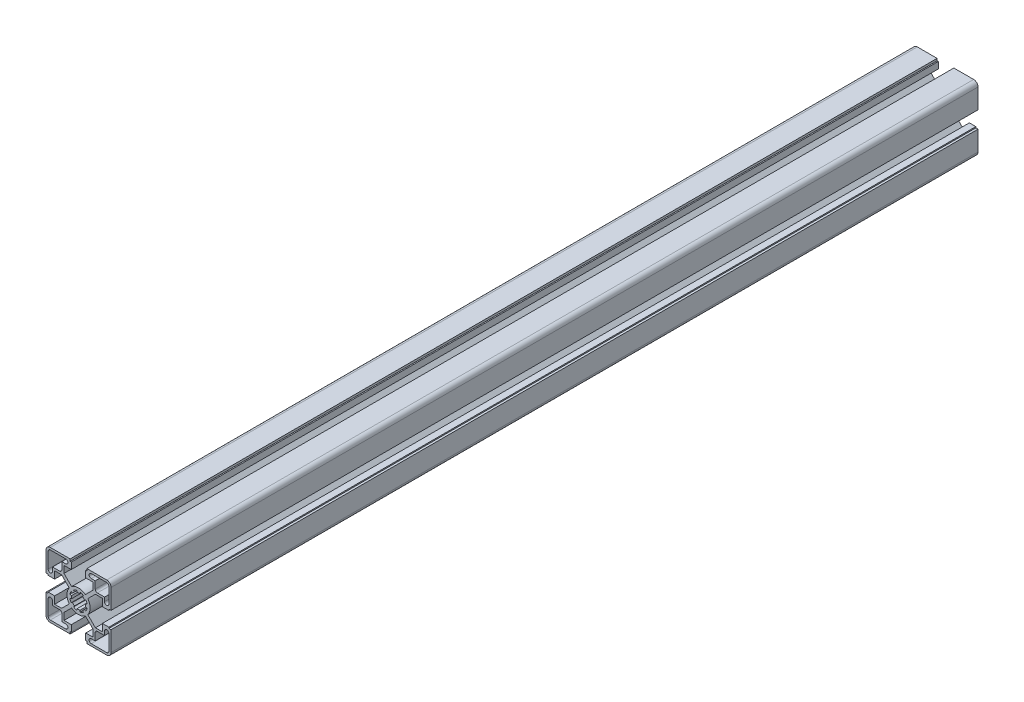
from build123d import *

# Parameters (mm, degrees)
BOSS_EXTRUDE1_DEPTH = 300


with BuildPart() as part:
    # Sketch1 → Boss-Extrude1 (new, symmetric)
    with BuildSketch(Plane.XY):
        with BuildLine():
            Line((-19.5072, 22.5044), (-5.7912, 22.5044))
            Line((-5.7912, 22.5044), (-5.7912, 21.0058))
            Line((-5.7912, 21.0058), (-5.0038, 21.0058))
            Line((-5.0038, 21.0058), (-5.0038, 16.51))
            Line((-5.0038, 16.51), (-10.0457, 16.51))
            Line((-10.0457, 16.51), (-10.0457, 11.680106614))
            Line((-10.0457, 11.680106614), (-4.781026704, 6.415433318))
            ThreePointArc((-4.781026704, 6.415433318), (0, 8.001), (4.781026704, 6.415433318))
            Line((4.781026704, 6.415433318), (10.0457, 11.680106614))
            Line((10.0457, 11.680106614), (10.0457, 16.51))
            Line((10.0457, 16.51), (5.0038, 16.51))
            Line((5.0038, 16.51), (5.0038, 21.0058))
            Line((5.0038, 21.0058), (5.7912, 21.0058))
            Line((5.7912, 21.0058), (5.7912, 22.5044))
            Line((5.7912, 22.5044), (19.5072, 22.5044))
            ThreePointArc((19.5072, 22.5044), (21.626540445, 21.626540445), (22.5044, 19.5072))
            Line((22.5044, 19.5072), (22.5044, 5.7912))
            Line((22.5044, 5.7912), (21.0058, 5.7912))
            Line((21.0058, 5.7912), (21.0058, 5.0038))
            Line((21.0058, 5.0038), (16.51, 5.0038))
            Line((16.51, 5.0038), (16.51, 10.0457))
            Line((16.51, 10.0457), (11.680106614, 10.0457))
            Line((11.680106614, 10.0457), (6.415433318, 4.781026704))
            ThreePointArc((6.415433318, 4.781026704), (8.001, 0), (6.415433318, -4.781026704))
            Line((6.415433318, -4.781026704), (11.680106614, -10.0457))
            Line((11.680106614, -10.0457), (16.51, -10.0457))
            Line((16.51, -10.0457), (16.51, -5.0038))
            Line((16.51, -5.0038), (21.0058, -5.0038))
            Line((21.0058, -5.0038), (21.0058, -5.7912))
            Line((21.0058, -5.7912), (22.5044, -5.7912))
            Line((22.5044, -5.7912), (22.5044, -19.5072))
            ThreePointArc((22.5044, -19.5072), (21.626540445, -21.626540445), (19.5072, -22.5044))
            Line((19.5072, -22.5044), (5.7912, -22.5044))
            Line((5.7912, -22.5044), (5.7912, -21.0058))
            Line((5.7912, -21.0058), (5.0038, -21.0058))
            Line((5.0038, -21.0058), (5.0038, -16.51))
            Line((5.0038, -16.51), (10.0457, -16.51))
            Line((10.0457, -16.51), (10.0457, -11.680106614))
            Line((10.0457, -11.680106614), (4.781026704, -6.415433318))
            ThreePointArc((4.781026704, -6.415433318), (0, -8.001), (-4.781026704, -6.415433318))
            Line((-4.781026704, -6.415433318), (-10.0457, -11.680106614))
            Line((-10.0457, -11.680106614), (-10.0457, -16.51))
            Line((-10.0457, -16.51), (-5.0038, -16.51))
            Line((-5.0038, -16.51), (-5.0038, -21.0058))
            Line((-5.0038, -21.0058), (-5.7912, -21.0058))
            Line((-5.7912, -21.0058), (-5.7912, -22.5044))
            Line((-5.7912, -22.5044), (-19.5072, -22.5044))
            ThreePointArc((-19.5072, -22.5044), (-21.626540445, -21.626540445), (-22.5044, -19.5072))
            Line((-22.5044, -19.5072), (-22.5044, -5.7912))
            Line((-22.5044, -5.7912), (-21.0058, -5.7912))
            Line((-21.0058, -5.7912), (-21.0058, -5.0038))
            Line((-21.0058, -5.0038), (-16.51, -5.0038))
            Line((-16.51, -5.0038), (-16.51, -10.0457))
            Line((-16.51, -10.0457), (-11.680106614, -10.0457))
            Line((-11.680106614, -10.0457), (-6.415433318, -4.781026704))
            ThreePointArc((-6.415433318, -4.781026704), (-8.001, 0), (-6.415433318, 4.781026704))
            Line((-6.415433318, 4.781026704), (-11.680106614, 10.0457))
            Line((-11.680106614, 10.0457), (-16.51, 10.0457))
            Line((-16.51, 10.0457), (-16.51, 5.0038))
            Line((-16.51, 5.0038), (-21.0058, 5.0038))
            Line((-21.0058, 5.0038), (-21.0058, 5.7912))
            Line((-21.0058, 5.7912), (-22.5044, 5.7912))
            Line((-22.5044, 5.7912), (-22.5044, 19.5072))
            ThreePointArc((-22.5044, 19.5072), (-21.626540445, 21.626540445), (-19.5072, 22.5044))
        make_face()
        with BuildLine():
            Line((-18.0086, 11.5443), (-13.0429, 11.5443))
            ThreePointArc((-13.0429, 11.5443), (-11.983229778, 11.983229778), (-11.5443, 13.0429))
            Line((-11.5443, 13.0429), (-11.5443, 18.0086))
            Line((-11.5443, 18.0086), (-8.7884, 18.0086))
            ThreePointArc((-8.7884, 18.0086), (-7.2898, 19.5072), (-8.7884, 21.0058))
            Line((-8.7884, 21.0058), (-19.5072, 21.0058))
            ThreePointArc((-19.5072, 21.0058), (-20.566870222, 20.566870222), (-21.0058, 19.5072))
            Line((-21.0058, 19.5072), (-21.0058, 8.7884))
            ThreePointArc((-21.0058, 8.7884), (-19.5072, 7.2898), (-18.0086, 8.7884))
            Line((-18.0086, 8.7884), (-18.0086, 11.5443))
        make_face(mode=Mode.SUBTRACT)
        with BuildLine():
            Line((1.189270603, 5.978867069), (0.976192953, 4.907653386))
            ThreePointArc((0.976192953, 4.907653386), (0, 5.0038), (-0.976192953, 4.907653386))
            Line((-0.976192953, 4.907653386), (-1.189270603, 5.978867069))
            ThreePointArc((-1.189270603, 5.978867069), (-2.332838204, 5.63196963), (-3.38675614, 5.068638757))
            Line((-3.38675614, 5.068638757), (-2.779962332, 4.160507646))
            ThreePointArc((-2.779962332, 4.160507646), (-3.538220912, 3.538220912), (-4.160507646, 2.779962332))
            Line((-4.160507646, 2.779962332), (-5.068638757, 3.38675614))
            ThreePointArc((-5.068638757, 3.38675614), (-5.63196963, 2.332838204), (-5.978867069, 1.189270603))
            Line((-5.978867069, 1.189270603), (-4.907653386, 0.976192953))
            ThreePointArc((-4.907653386, 0.976192953), (-5.0038, 0), (-4.907653386, -0.976192953))
            Line((-4.907653386, -0.976192953), (-5.978867069, -1.189270603))
            ThreePointArc((-5.978867069, -1.189270603), (-5.63196963, -2.332838204), (-5.068638757, -3.38675614))
            Line((-5.068638757, -3.38675614), (-4.160507646, -2.779962332))
            ThreePointArc((-4.160507646, -2.779962332), (-3.538220912, -3.538220912), (-2.779962332, -4.160507646))
            Line((-2.779962332, -4.160507646), (-3.38675614, -5.068638757))
            ThreePointArc((-3.38675614, -5.068638757), (-2.332838204, -5.63196963), (-1.189270603, -5.978867069))
            Line((-1.189270603, -5.978867069), (-0.976192953, -4.907653386))
            ThreePointArc((-0.976192953, -4.907653386), (0, -5.0038), (0.976192953, -4.907653386))
            Line((0.976192953, -4.907653386), (1.189270603, -5.978867069))
            ThreePointArc((1.189270603, -5.978867069), (2.332838204, -5.63196963), (3.38675614, -5.068638757))
            Line((3.38675614, -5.068638757), (2.779962332, -4.160507646))
            ThreePointArc((2.779962332, -4.160507646), (3.538220912, -3.538220912), (4.160507646, -2.779962332))
            Line((4.160507646, -2.779962332), (5.068638757, -3.38675614))
            ThreePointArc((5.068638757, -3.38675614), (5.63196963, -2.332838204), (5.978867069, -1.189270603))
            Line((5.978867069, -1.189270603), (4.907653386, -0.976192953))
            ThreePointArc((4.907653386, -0.976192953), (5.0038, 0), (4.907653386, 0.976192953))
            Line((4.907653386, 0.976192953), (5.978867069, 1.189270603))
            ThreePointArc((5.978867069, 1.189270603), (5.63196963, 2.332838204), (5.068638757, 3.38675614))
            Line((5.068638757, 3.38675614), (4.160507646, 2.779962332))
            ThreePointArc((4.160507646, 2.779962332), (3.538220912, 3.538220912), (2.779962332, 4.160507646))
            Line((2.779962332, 4.160507646), (3.38675614, 5.068638757))
            ThreePointArc((3.38675614, 5.068638757), (2.332838204, 5.63196963), (1.189270603, 5.978867069))
        make_face(mode=Mode.SUBTRACT)
        with BuildLine():
            Line((11.5443, 18.0086), (8.7884, 18.0086))
            ThreePointArc((8.7884, 18.0086), (7.2898, 19.5072), (8.7884, 21.0058))
            Line((8.7884, 21.0058), (19.5072, 21.0058))
            ThreePointArc((19.5072, 21.0058), (20.566870222, 20.566870222), (21.0058, 19.5072))
            Line((21.0058, 19.5072), (21.0058, 8.7884))
            ThreePointArc((21.0058, 8.7884), (19.5072, 7.2898), (18.0086, 8.7884))
            Line((18.0086, 8.7884), (18.0086, 11.5443))
            Line((18.0086, 11.5443), (13.0429, 11.5443))
            ThreePointArc((13.0429, 11.5443), (11.983229778, 11.983229778), (11.5443, 13.0429))
            Line((11.5443, 13.0429), (11.5443, 18.0086))
        make_face(mode=Mode.SUBTRACT)
        with BuildLine():
            Line((18.0086, -11.5443), (13.0429, -11.5443))
            ThreePointArc((13.0429, -11.5443), (11.983229778, -11.983229778), (11.5443, -13.0429))
            Line((11.5443, -13.0429), (11.5443, -18.0086))
            Line((11.5443, -18.0086), (8.7884, -18.0086))
            ThreePointArc((8.7884, -18.0086), (7.2898, -19.5072), (8.7884, -21.0058))
            Line((8.7884, -21.0058), (19.5072, -21.0058))
            ThreePointArc((19.5072, -21.0058), (20.566870222, -20.566870222), (21.0058, -19.5072))
            Line((21.0058, -19.5072), (21.0058, -8.7884))
            ThreePointArc((21.0058, -8.7884), (19.5072, -7.2898), (18.0086, -8.7884))
            Line((18.0086, -8.7884), (18.0086, -11.5443))
        make_face(mode=Mode.SUBTRACT)
        with BuildLine():
            Line((-11.5443, -18.0086), (-8.7884, -18.0086))
            ThreePointArc((-8.7884, -18.0086), (-7.2898, -19.5072), (-8.7884, -21.0058))
            Line((-8.7884, -21.0058), (-19.5072, -21.0058))
            ThreePointArc((-19.5072, -21.0058), (-20.566870222, -20.566870222), (-21.0058, -19.5072))
            Line((-21.0058, -19.5072), (-21.0058, -8.7884))
            ThreePointArc((-21.0058, -8.7884), (-19.5072, -7.2898), (-18.0086, -8.7884))
            Line((-18.0086, -8.7884), (-18.0086, -11.5443))
            Line((-18.0086, -11.5443), (-13.0429, -11.5443))
            ThreePointArc((-13.0429, -11.5443), (-11.983229778, -11.983229778), (-11.5443, -13.0429))
            Line((-11.5443, -13.0429), (-11.5443, -18.0086))
        make_face(mode=Mode.SUBTRACT)
    extrude(amount=BOSS_EXTRUDE1_DEPTH, both=True)


solid = part.part
